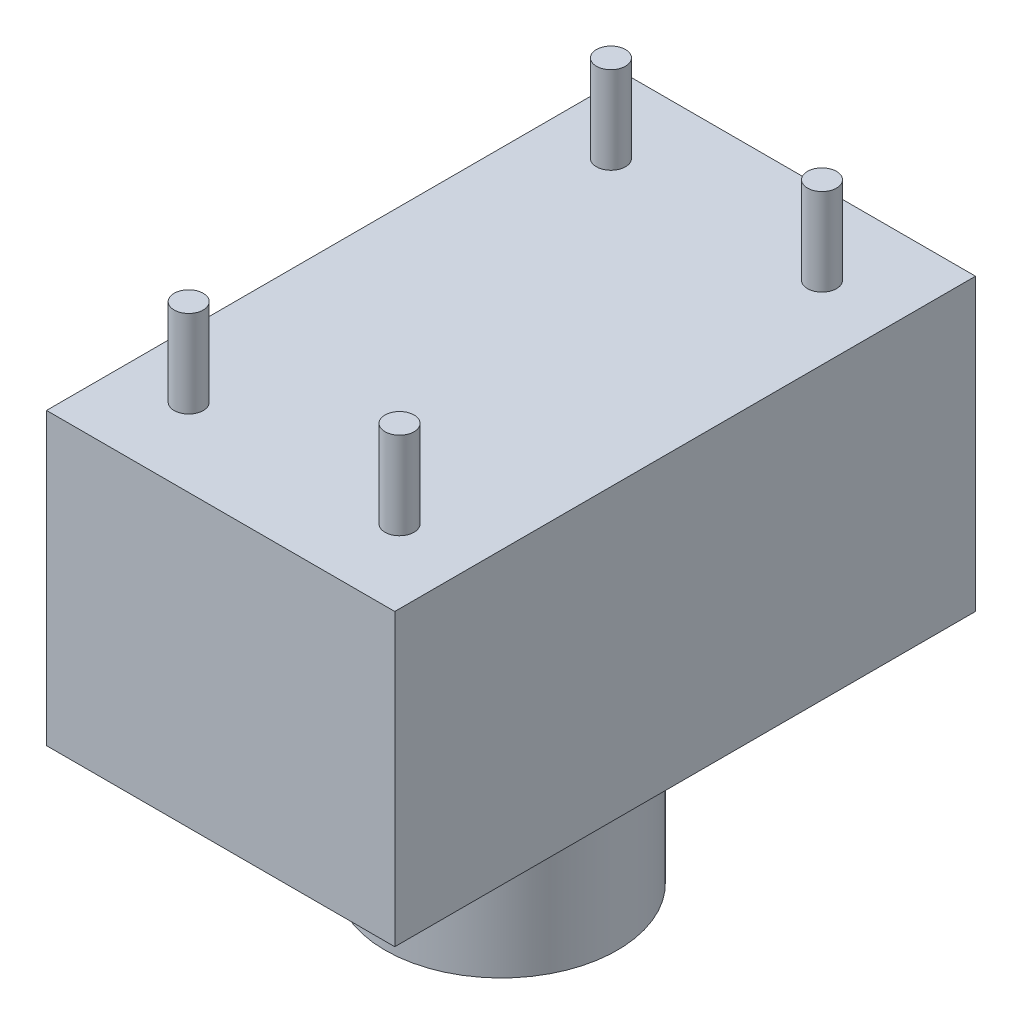
from build123d import *

# Parameters (mm, degrees)
BOSS_EXTRUDE1_DEPTH      = 10
BOSS_EXTRUDE1_DEPTH_BACK = 0.0001
SKETCH2_W                = 11.99345044
SKETCH2_H                = 20
SKETCH3_R                = 4
BOSS_EXTRUDE3_DEPTH      = 6
SKETCH4_R                = 0.5
BOSS_EXTRUDE4_DEPTH      = 3


with BuildPart() as part:
    # Sketch2 → Boss-Extrude1 (new, two sides: drawn at the far end of the back side and taken through both)
    with BuildSketch(Plane(origin=(0, 0, -0.145481973), x_dir=(1, 0, 0), z_dir=(0, 1, 0)).offset(-BOSS_EXTRUDE1_DEPTH_BACK)):
        with Locations((-86.219016819, 27.840556499)):
            Rectangle(SKETCH2_W, SKETCH2_H)
    extrude(amount=BOSS_EXTRUDE1_DEPTH + BOSS_EXTRUDE1_DEPTH_BACK)

    # Sketch3 → Boss-Extrude3 (add)
    with BuildSketch(Plane(origin=(-2.285199676, 0, 0), x_dir=(1, 0, 0), z_dir=(0, 1, 0))):
        with Locations(Location((-83.999243897, 27.714265915, 0), (0, 0, 270))):
            Circle(SKETCH3_R)
    extrude(amount=-BOSS_EXTRUDE3_DEPTH)

    # Sketch4 → Boss-Extrude4 (add)
    with BuildSketch(Plane(origin=(-0.419617144, 10, -0.145481973), x_dir=(1, 0, 0), z_dir=(0, 1, 0))):
        with Locations(Location((-89.592112579, 35.075202762, 0), (0, 0, 270))):
            Circle(SKETCH4_R)
        with Locations(Location((-82.322613513, 35.075202762, 0), (0, 0, 270))):
            Circle(SKETCH4_R)
        with Locations(Location((-82.331654895, 20.533744188, 0), (0, 0, 270))):
            Circle(SKETCH4_R)
        with Locations(Location((-89.592112579, 20.533744188, 0), (0, 0, 270))):
            Circle(SKETCH4_R)
    extrude(amount=BOSS_EXTRUDE4_DEPTH)


solid = part.part
